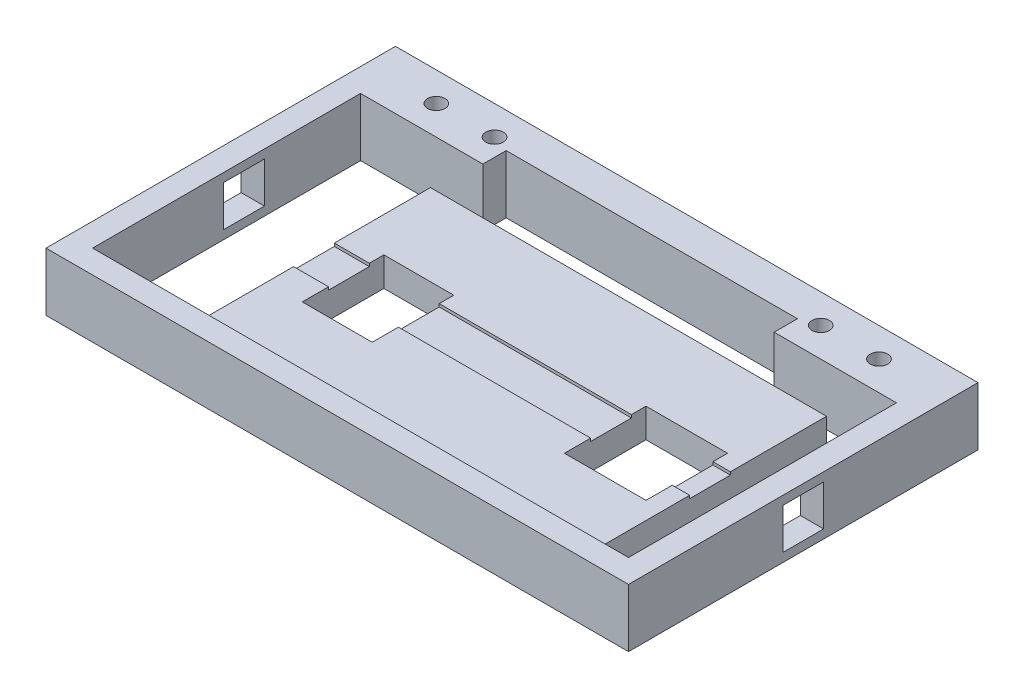
from build123d import *

# Parameters (mm, degrees)
CROQUIS1_W                   = 100
CROQUIS1_H                   = 60
CROQUIS1_R                   = 1.5
SALIENTE_EXTRUIR1_DEPTH      = 10
SALIENTE_EXTRUIR2_DEPTH      = 2
SALIENTE_EXTRUIR2_DEPTH_BACK = 3
CROQUIS1_2_W                 = 92
CROQUIS1_2_H                 = 46
CROQUIS2_W                   = 12
CROQUIS2_H                   = 14
CROQUIS2_W_2                 = 14
CORTAR_EXTRUIR1_DEPTH        = 5
CORTAR_EXTRUIR2_START        = -5
CROQUIS3_W                   = 12
CROQUIS3_H                   = 46
CORTAR_EXTRUIR2_DEPTH        = 5
MATRIZL1_COUNT               = 2
MATRIZL1_PITCH               = 80
CROQUIS4_W                   = 7
CROQUIS4_H                   = 7
CORTAR_EXTRUIR3_DEPTH        = 100
MATRIZL2_COUNT               = 2
MATRIZL2_PITCH               = 96


with BuildPart() as part:
    # Croquis1 → Saliente-Extruir1 (new body)
    with BuildSketch(Plane(origin=(0, 0, 0), x_dir=(1, 0, 0), z_dir=(0, 1, 0))):
        Rectangle(CROQUIS1_W, CROQUIS1_H)
        Polygon((-46, 20), (-25, 20), (-25, 24), (25, 24), (25, 20), (46, 20), (46, -26), (-46, -26), align=None, mode=Mode.SUBTRACT)
        with Locations(Location((-38, 25, 0), (0, 0, 270))):
            Circle(CROQUIS1_R, mode=Mode.SUBTRACT)
        with Locations(Location((-28, 25, 0), (0, 0, 270))):
            Circle(CROQUIS1_R, mode=Mode.SUBTRACT)
        with Locations(Location((28, 25, 0), (0, 0, 270))):
            Circle(CROQUIS1_R, mode=Mode.SUBTRACT)
        with Locations(Location((38, 25, 0), (0, 0, 270))):
            Circle(CROQUIS1_R, mode=Mode.SUBTRACT)
    extrude(amount=SALIENTE_EXTRUIR1_DEPTH)

    # Croquis1<2> → Saliente-Extruir2 (add, two sides: drawn at the far end of the back side and taken through both)
    with BuildSketch(Plane(origin=(0, 0, 0), x_dir=(1, 0, 0), z_dir=(0, 1, 0)).offset(-SALIENTE_EXTRUIR2_DEPTH_BACK)):
        with Locations((0, -3)):
            Rectangle(CROQUIS1_2_W, CROQUIS1_2_H)
    extrude(amount=SALIENTE_EXTRUIR2_DEPTH + SALIENTE_EXTRUIR2_DEPTH_BACK)

    # Croquis2 → Cortar-Extruir1 (cut)
    with BuildSketch(Plane(origin=(0, 2, 0), x_dir=(1, 0, 0), z_dir=(0, 1, 0))):
        with Locations((-22, -1)):
            Rectangle(CROQUIS2_W, CROQUIS2_H)
        with Locations((24, -1)):
            Rectangle(CROQUIS2_W_2, CROQUIS2_H)
    extrude(amount=-CORTAR_EXTRUIR1_DEPTH, mode=Mode.SUBTRACT)

    # Croquis3 → Cortar-Extruir2 (cut)
    with BuildSketch(Plane(origin=(0, 2, 0), x_dir=(1, 0, 0), z_dir=(0, 1, 0)).offset(CORTAR_EXTRUIR2_START)):
        with Locations((40, -3)):
            Rectangle(CROQUIS3_W, CROQUIS3_H)
    cortar_extruir2 = extrude(amount=CORTAR_EXTRUIR2_DEPTH, mode=Mode.SUBTRACT)

    # MatrizL1: Cortar-Extruir2 ×2
    with Locations(*[(-i * MATRIZL1_PITCH, 0, 0) for i in range(1, MATRIZL1_COUNT)]):
        add(cortar_extruir2, mode=Mode.SUBTRACT)

    # Croquis4 → Cortar-Extruir3 (cut)
    with BuildSketch(Plane.ZY.offset(-46)):
        with Locations((0, 5)):
            Rectangle(CROQUIS4_W, CROQUIS4_H)
    cortar_extruir3 = extrude(amount=-CORTAR_EXTRUIR3_DEPTH, mode=Mode.SUBTRACT)

    # MatrizL2: Cortar-Extruir3 ×2
    with Locations(*[(-i * MATRIZL2_PITCH, 0, 0) for i in range(1, MATRIZL2_COUNT)]):
        add(cortar_extruir3, mode=Mode.SUBTRACT)


solid = part.part
